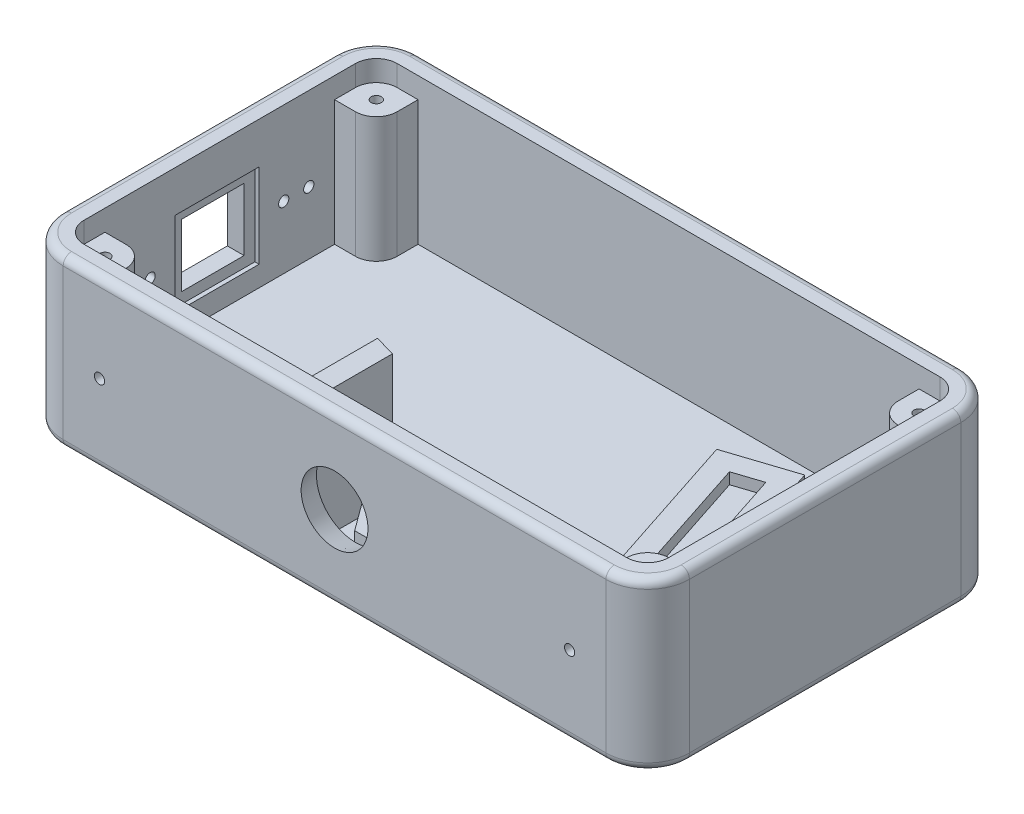
from build123d import *

# Parameters (mm, degrees)
EXTRUDE_1_DEPTH     = 5
EXTRUDE_3_DEPTH     = 10
EXTRUDE_6_DEPTH     = 35
EXTRUDE_7_DEPTH     = 40
EXTRUDE_8_DEPTH     = 13
SKETCH_1_12_W       = 1
SKETCH_1_12_H       = 20
EXTRUDE_9_DEPTH     = 40
SKETCH_3_R          = 8
CUT_EXTRUDE_2_DEPTH = 5
CUT_EXTRUDE_2_DRAFT = 15
SKETCH_3_3_R        = 1.225
CUT_EXTRUDE_3_DEPTH = 5
EXTRUDE_10_DEPTH    = 7.3
EXTRUDE_11_DEPTH    = 10
SKETCH_1_17_R       = 1.225
EXTRUDE_12_DEPTH    = 35
SKETCH_4_W          = 20.2
SKETCH_4_H          = 20.2
SKETCH_4_W_2        = 15
SKETCH_4_H_2        = 15
CUT_EXTRUDE_4_DEPTH = 1
SKETCH_4_2_W        = 15
SKETCH_4_2_H        = 15
CUT_EXTRUDE_5_DEPTH = 5
SKETCH_4_4_R        = 1.225
CUT_EXTRUDE_6_DEPTH = 5
FILLET_1_R          = 2
FILLET_2_R          = 2


with BuildPart() as part:
    # 草图1 → 凸台-拉伸1 (new body)
    with BuildSketch(Plane(origin=(0, 0, 0), x_dir=(1, 0, 0), z_dir=(0, 1, 0))):
        with BuildLine():
            Line((75, 33.176192778), (75, -31.823807222))
            ThreePointArc((75, -31.823807222), (72.071067812, -38.894875033), (65, -41.823807222))
            Line((65, -41.823807222), (-65, -41.823807222))
            ThreePointArc((-65, -41.823807222), (-72.071067812, -38.894875033), (-75, -31.823807222))
            Line((-75, -31.823807222), (-75, 33.176192778))
            ThreePointArc((-75, 33.176192778), (-72.071067812, 40.24726059), (-65, 43.176192778))
            Line((-65, 43.176192778), (65, 43.176192778))
            ThreePointArc((65, 43.176192778), (72.071067812, 40.24726059), (75, 33.176192778))
        make_face()
    extrude(amount=EXTRUDE_1_DEPTH)

    # 草图1<5> → 凸台-拉伸3 (add)
    with BuildSketch(Plane(origin=(0, 0, 0), x_dir=(1, 0, 0), z_dir=(0, 1, 0))):
        Polygon((57.842076132, -25.396380983), (39.164167684, 31.622350466), (23.293954098, 26.423665948), (41.971862546, -30.595065501), align=None)
        Polygon((29.475846356, 23.292498736), (36.033000472, 25.440458207), (51.660183874, -22.265213771), (45.103029757, -24.413173243), align=None, mode=Mode.SUBTRACT)
    extrude(amount=EXTRUDE_3_DEPTH)

    # 草图1<7> → 凸台-拉伸6 (add)
    with BuildSketch(Plane(origin=(0, 0, 0), x_dir=(1, 0, 0), z_dir=(0, 1, 0))):
        Polygon((-15.358382401, -16.165434366), (-15.358382401, -36.823807222), (-10.358382401, -36.823807222), (-10.358382401, -22.958803378), (-10.358382401, -17.618073152), align=None)
    extrude(amount=EXTRUDE_6_DEPTH)

    # 草图1<8> → 凸台-拉伸7 (add)
    with BuildSketch(Plane(origin=(0, 0, 0), x_dir=(1, 0, 0), z_dir=(0, 1, 0))):
        with BuildLine():
            Line((75, -31.823807222), (75, 33.176192778))
            ThreePointArc((75, 33.176192778), (72.071067812, 40.24726059), (65, 43.176192778))
            Line((65, 43.176192778), (-65, 43.176192778))
            ThreePointArc((-65, 43.176192778), (-72.071067812, 40.24726059), (-75, 33.176192778))
            Line((-75, 33.176192778), (-75, -31.823807222))
            ThreePointArc((-75, -31.823807222), (-72.071067812, -38.894875033), (-65, -41.823807222))
            Line((-65, -41.823807222), (65, -41.823807222))
            ThreePointArc((65, -41.823807222), (72.071067812, -38.894875033), (75, -31.823807222))
        make_face()
        with BuildLine():
            Line((-60, -36.823807222), (-65, -36.823807222))
            ThreePointArc((-65, -36.823807222), (-68.535533906, -35.359341128), (-70, -31.823807222))
            Line((-70, -31.823807222), (-70, -26.823807222))
            Line((-70, -26.823807222), (-70, -10))
            Line((-70, -10), (-71, -10))
            Line((-71, -10), (-71, 10))
            Line((-71, 10), (-70, 10))
            Line((-70, 10), (-70, 28.176192778))
            Line((-70, 28.176192778), (-70, 33.176192778))
            ThreePointArc((-70, 33.176192778), (-68.535533906, 36.711726684), (-65, 38.176192778))
            Line((-65, 38.176192778), (-60, 38.176192778))
            Line((-60, 38.176192778), (60, 38.176192778))
            Line((60, 38.176192778), (65, 38.176192778))
            ThreePointArc((65, 38.176192778), (68.535533906, 36.711726684), (70, 33.176192778))
            Line((70, 33.176192778), (70, 28.176192778))
            Line((70, 28.176192778), (70, -26.823807222))
            Line((70, -26.823807222), (70, -31.823807222))
            ThreePointArc((70, -31.823807222), (68.535533906, -35.359341128), (65, -36.823807222))
            Line((65, -36.823807222), (60, -36.823807222))
            Line((60, -36.823807222), (14.702057154, -36.823807222))
            Line((14.702057154, -36.823807222), (8.624059224, -36.823807222))
            Line((8.624059224, -36.823807222), (5.895162194, -36.823807222))
            Line((5.895162194, -36.823807222), (-0.182835736, -36.823807222))
            Line((-0.182835736, -36.823807222), (-10.358382401, -36.823807222))
            Line((-10.358382401, -36.823807222), (-15.358382401, -36.823807222))
            Line((-15.358382401, -36.823807222), (-60, -36.823807222))
        make_face(mode=Mode.SUBTRACT)
    extrude(amount=EXTRUDE_7_DEPTH)

    # 草图1<11> → 凸台-拉伸8 (add)
    with BuildSketch(Plane(origin=(0, 0, 0), x_dir=(1, 0, 0), z_dir=(0, 1, 0))):
        Polygon((-10.358382401, -22.958803378), (-0.182835736, -36.823807222), (5.895162194, -36.823807222), (-6.056399498, -20.538839518), (-4.282789154, -19.237184284), (7.668772538, -35.522151988), (8.624059224, -36.823807222), (14.702057154, -36.823807222), (14.518227689, -36.573324733), (-3.231616409, -12.387729133), (-10.358382401, -17.618073152), align=None)
    extrude(amount=EXTRUDE_8_DEPTH)

    # 草图1<12> → 凸台-拉伸9 (add)
    with BuildSketch(Plane(origin=(0, 0, 0), x_dir=(1, 0, 0), z_dir=(0, 1, 0))):
        with Locations((-70.5, 0)):
            Rectangle(SKETCH_1_12_W, SKETCH_1_12_H)
    extrude(amount=EXTRUDE_9_DEPTH)


with BuildPart() as cut_extrude_2_tool:
    # 草图3 → 切除-拉伸2 (with draft: the straight prism first)
    with BuildSketch(Plane.XY.offset(41.823807222)):
        with Locations((0, 20)):
            Circle(SKETCH_3_R)
    extrude(amount=-CUT_EXTRUDE_2_DEPTH)
    # 切除-拉伸2: the draft: its side faces are tilted about the plane it starts from
    cut_extrude_2_sides = [cut_extrude_2_tool.faces().sort_by_distance(p)[0] for p in [
        (-8, 20, 39.323807222),
    ]]
    draft(cut_extrude_2_sides, Plane.XY.offset(41.823807222), CUT_EXTRUDE_2_DRAFT)


with BuildPart() as part_1:
    add(part.part)

    # 切除-拉伸2: cut by cut_extrude_2_tool
    add(cut_extrude_2_tool.part, mode=Mode.SUBTRACT)

    # 草图3<3> → 切除-拉伸3 (cut)
    with BuildSketch(Plane.XY.offset(41.823807222)):
        with Locations((56.3, 19)):
            Circle(SKETCH_3_3_R)
        with Locations((-56.3, 19)):
            Circle(SKETCH_3_3_R)
    extrude(amount=-CUT_EXTRUDE_3_DEPTH, mode=Mode.SUBTRACT)

    # 草图1<13> → 凸台-拉伸10 (add)
    with BuildSketch(Plane(origin=(0, 0, 0), x_dir=(1, 0, 0), z_dir=(0, 1, 0))):
        Polygon((36.033000472, 25.440458207), (29.475846356, 23.292498736), (45.103029757, -24.413173243), (51.660183874, -22.265213771), align=None)
    extrude(amount=EXTRUDE_10_DEPTH)

    # 草图1<16> → 凸台-拉伸11 (add)
    with BuildSketch(Plane(origin=(0, 0, 0), x_dir=(1, 0, 0), z_dir=(0, 1, 0))):
        Polygon((-6.056399498, -20.538839518), (5.895162194, -36.823807222), (8.624059224, -36.823807222), (7.668772538, -35.522151988), (-4.282789154, -19.237184284), align=None)
    extrude(amount=EXTRUDE_11_DEPTH)

    # 草图1<17> → 凸台-拉伸12 (add)
    # profile 1 of 4: a face of its own
    with BuildSketch(Plane(origin=(0, 0, 0), x_dir=(1, 0, 0), z_dir=(0, 1, 0))):
        with BuildLine():
            ThreePointArc((-70, -31.823807222), (-68.535533906, -35.359341128), (-65, -36.823807222))
            Line((-65, -36.823807222), (-60, -36.823807222))
            Line((-60, -36.823807222), (-60, -31.823807222))
            ThreePointArc((-60, -31.823807222), (-61.464466094, -28.288273316), (-65, -26.823807222))
            Line((-65, -26.823807222), (-70, -26.823807222))
            Line((-70, -26.823807222), (-70, -31.823807222))
        make_face()
        with Locations((-65, -31.823807222)):
            Circle(SKETCH_1_17_R, mode=Mode.SUBTRACT)
    # profile 2 of 4: a face of its own
    with BuildSketch(Plane(origin=(0, 0, 0), x_dir=(1, 0, 0), z_dir=(0, 1, 0))):
        with BuildLine():
            Line((-70, 33.176192778), (-70, 28.176192778))
            Line((-70, 28.176192778), (-65, 28.176192778))
            ThreePointArc((-65, 28.176192778), (-61.464466094, 29.640658872), (-60, 33.176192778))
            Line((-60, 33.176192778), (-60, 38.176192778))
            Line((-60, 38.176192778), (-65, 38.176192778))
            ThreePointArc((-65, 38.176192778), (-68.535533906, 36.711726684), (-70, 33.176192778))
        make_face()
        with Locations((-65, 33.176192778)):
            Circle(SKETCH_1_17_R, mode=Mode.SUBTRACT)
    # profile 3 of 4: a face of its own
    with BuildSketch(Plane(origin=(0, 0, 0), x_dir=(1, 0, 0), z_dir=(0, 1, 0))):
        with BuildLine():
            Line((60, -31.823807222), (60, -36.823807222))
            Line((60, -36.823807222), (65, -36.823807222))
            ThreePointArc((65, -36.823807222), (68.535533906, -35.359341128), (70, -31.823807222))
            Line((70, -31.823807222), (70, -26.823807222))
            Line((70, -26.823807222), (65, -26.823807222))
            ThreePointArc((65, -26.823807222), (61.464466094, -28.288273316), (60, -31.823807222))
        make_face()
        with Locations((65, -31.823807222)):
            Circle(SKETCH_1_17_R, mode=Mode.SUBTRACT)
    # profile 4 of 4: a face of its own
    with BuildSketch(Plane(origin=(0, 0, 0), x_dir=(1, 0, 0), z_dir=(0, 1, 0))):
        with BuildLine():
            Line((65, 38.176192778), (60, 38.176192778))
            Line((60, 38.176192778), (60, 33.176192778))
            ThreePointArc((60, 33.176192778), (61.464466094, 29.640658872), (65, 28.176192778))
            Line((65, 28.176192778), (70, 28.176192778))
            Line((70, 28.176192778), (70, 33.176192778))
            ThreePointArc((70, 33.176192778), (68.535533906, 36.711726684), (65, 38.176192778))
        make_face()
        with Locations((65, 33.176192778)):
            Circle(SKETCH_1_17_R, mode=Mode.SUBTRACT)
    extrude(amount=EXTRUDE_12_DEPTH)

    # 草图4 → 切除-拉伸4 (cut)
    with BuildSketch(Plane(origin=(-70, 0, 0), x_dir=(0, 0, -1), z_dir=(1, 0, 0))):
        with Locations((0, 20)):
            Rectangle(SKETCH_4_W, SKETCH_4_H)
        with Locations((0, 20)):
            Rectangle(SKETCH_4_W_2, SKETCH_4_H_2, mode=Mode.SUBTRACT)
    extrude(amount=-CUT_EXTRUDE_4_DEPTH, mode=Mode.SUBTRACT)

    # 草图4<2> → 切除-拉伸5 (cut)
    with BuildSketch(Plane(origin=(-70, 0, 0), x_dir=(0, 0, -1), z_dir=(1, 0, 0))):
        with Locations((0, 20)):
            Rectangle(SKETCH_4_2_W, SKETCH_4_2_H)
    extrude(amount=-CUT_EXTRUDE_5_DEPTH, mode=Mode.SUBTRACT)

    # 草图4<4> → 切除-拉伸6 (cut)
    with BuildSketch(Plane(origin=(-70, 0, 0), x_dir=(0, 0, -1), z_dir=(1, 0, 0))):
        with Locations((-22, 20)):
            Circle(SKETCH_4_4_R)
        with Locations((22, 20)):
            Circle(SKETCH_4_4_R)
        with Locations((-16, 20)):
            Circle(SKETCH_4_4_R)
        with Locations((16, 20)):
            Circle(SKETCH_4_4_R)
    extrude(amount=-CUT_EXTRUDE_6_DEPTH, mode=Mode.SUBTRACT)

    # 圆角1
    fillet_1_edges = [part_1.edges().sort_by_distance(p)[0] for p in [
        (72.071067812, 40, -40.24726059),
        (72.071067812, 40, 38.894875033),
        (-72.071067812, 40, -40.24726059),
        (-72.071067812, 40, 38.894875033),
        (75, 40, -0.676192778),
        (0, 40, -43.176192778),
        (-75, 40, -0.676192778),
        (0, 40, 41.823807222),
    ]]
    fillet(fillet_1_edges, radius=FILLET_1_R)

    # 圆角2
    fillet_2_edges = [part_1.edges().sort_by_distance(p)[0] for p in [
        (-72.071067812, 0, 38.894875033),
        (-75, 0, -0.676192778),
        (-72.071067812, 0, -40.24726059),
        (0, 0, -43.176192778),
        (72.071067812, 0, -40.24726059),
        (75, 0, -0.676192778),
        (72.071067812, 0, 38.894875033),
        (0, 0, 41.823807222),
    ]]
    fillet(fillet_2_edges, radius=FILLET_2_R)


solid = part_1.part
